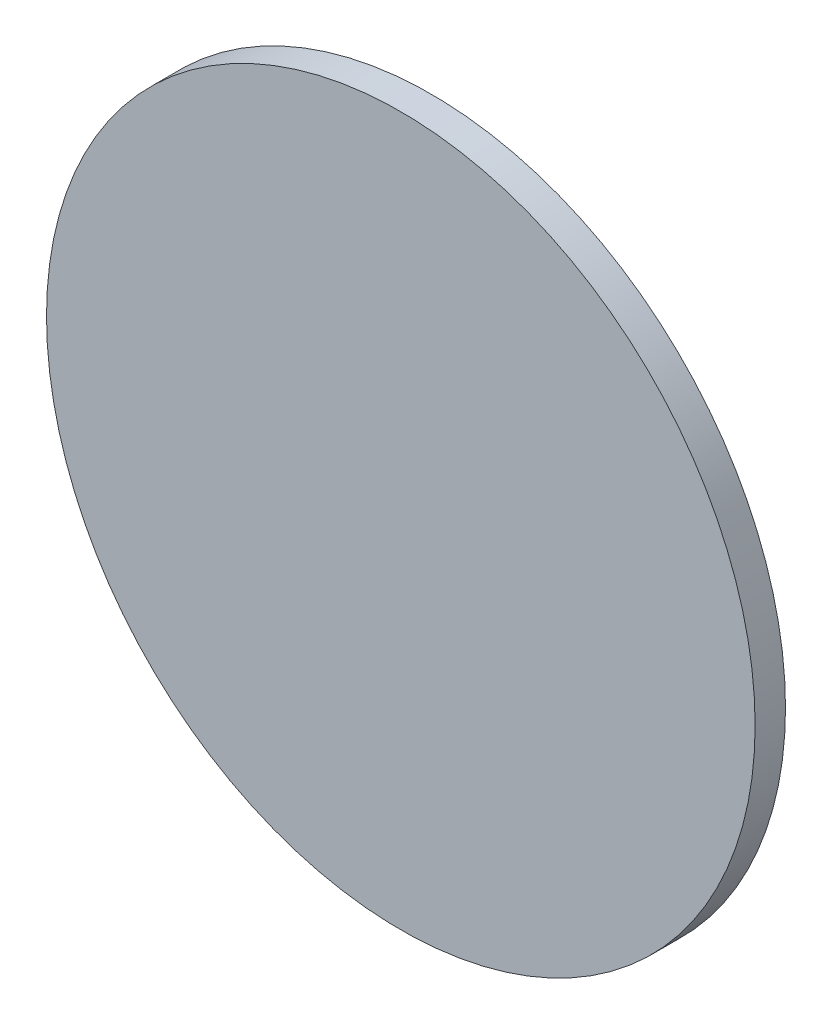
from build123d import *

# Parameters (mm, degrees)
SKETCH1_R           = 17.5
BOSS_EXTRUDE1_DEPTH = 1.5


with BuildPart() as part:
    # Sketch1 → Boss-Extrude1 (new body)
    with BuildSketch(Plane.XY):
        Circle(SKETCH1_R)
    extrude(amount=BOSS_EXTRUDE1_DEPTH)


solid = part.part
